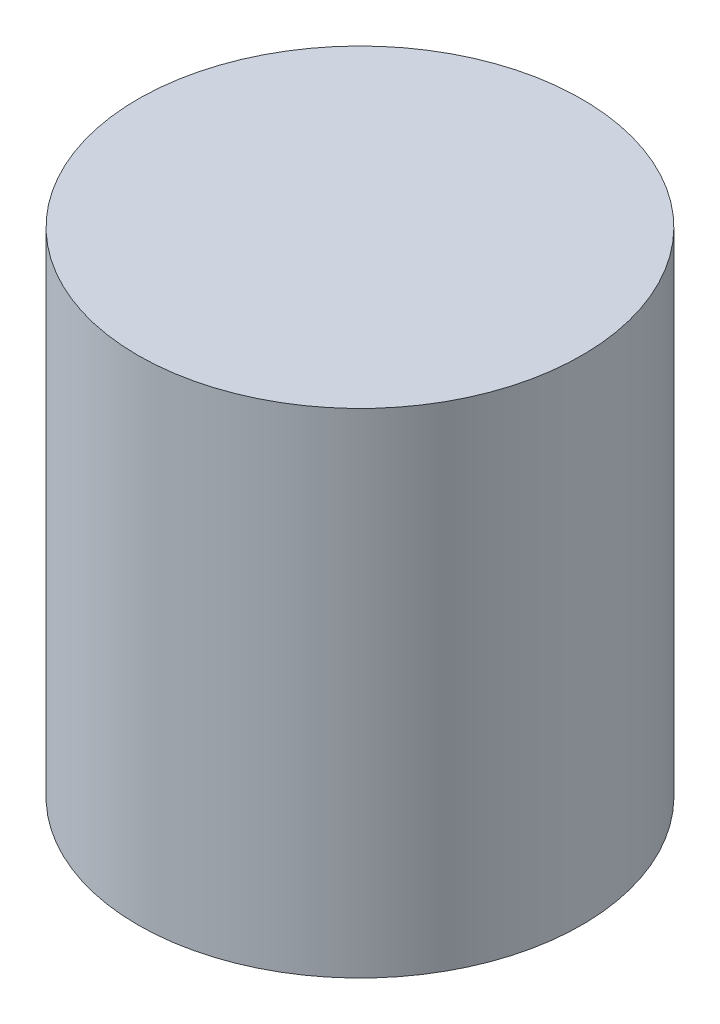
from build123d import *

# Parameters (mm, degrees)
SKETCH1_R           = 9
BOSS_EXTRUDE1_DEPTH = 20


with BuildPart() as part:
    # Sketch1 → Boss-Extrude1 (new body)
    with BuildSketch(Plane(origin=(0, 0, 0), x_dir=(1, 0, 0), z_dir=(0, 1, 0))):
        with Locations(Location((0, 0, 0), (0, 0, 270))):
            Circle(SKETCH1_R)
    extrude(amount=BOSS_EXTRUDE1_DEPTH)


solid = part.part
